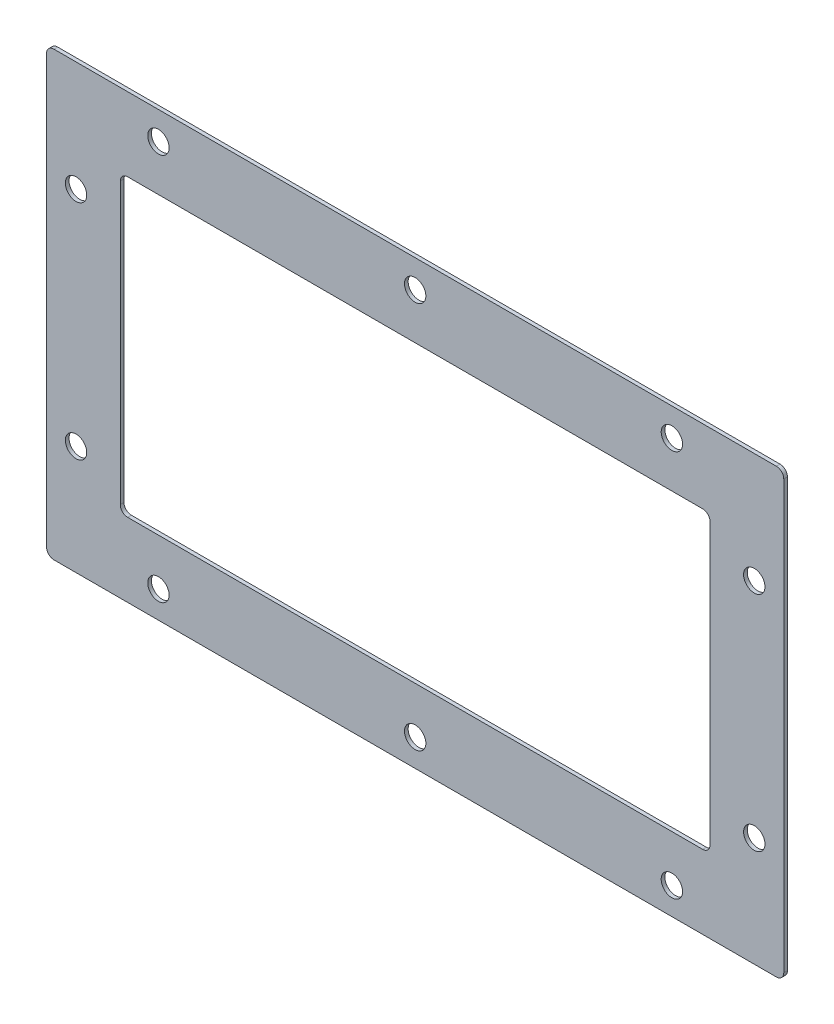
from build123d import *

# Parameters (mm, degrees)
SKETCH1_W            = 200
SKETCH1_H            = 120
SKETCH1_W_2          = 160
SKETCH1_H_2          = 80
BOSS_EXTRUDE1_DEPTH  = 1
FILLET1_R            = 2
M5_CLEARANCE_HOLE1_D = 5.8


with BuildPart() as part:
    # Sketch1 → Boss-Extrude1 (new body)
    with BuildSketch(Plane.XY):
        Rectangle(SKETCH1_W, SKETCH1_H)
        Rectangle(SKETCH1_W_2, SKETCH1_H_2, mode=Mode.SUBTRACT)
    extrude(amount=BOSS_EXTRUDE1_DEPTH)

    # Fillet1
    fillet1_edges = [part.edges().sort_by_distance(p)[0] for p in [
        (-80, 40, 0.5),
        (-80, -40, 0.5),
        (80, -40, 0.5),
        (80, 40, 0.5),
        (-100, 60, 0.5),
        (100, 60, 0.5),
        (100, -60, 0.5),
        (-100, -60, 0.5),
    ]]
    fillet(fillet1_edges, radius=FILLET1_R)

    # M5 Clearance Hole1 (through all)
    with Locations(Plane.XY.offset(1)):
        with Locations((92, -30.334149623), (69.646446609, -52.66277265), (92, 30.107073019), (0, -52.66277265), (69.646446609, 52.435696047), (0, 52.435696047), (-69.646446609, 52.435696047), (-92, 30.107073019), (-92, -30.334149623), (-69.646446609, -52.66277265)):
            Hole(M5_CLEARANCE_HOLE1_D / 2)


solid = part.part
